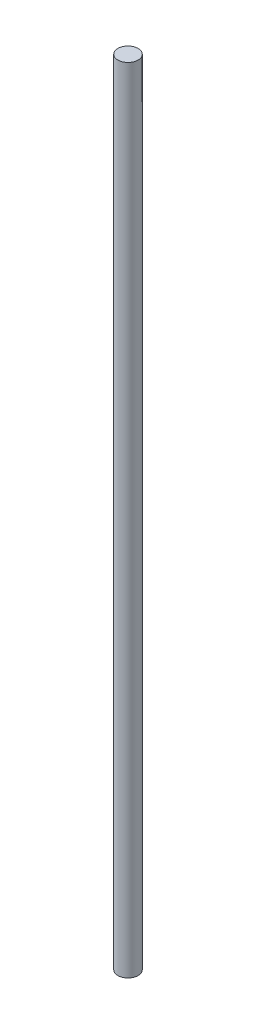
from build123d import *

# Parameters (mm, degrees)
SKETCH_1_R      = 2.8
EXTRUDE_1_DEPTH = 220


with BuildPart() as part:
    # 草图1 → 凸台-拉伸1 (new body)
    with BuildSketch(Plane(origin=(0, 0, 0), x_dir=(1, 0, 0), z_dir=(0, 1, 0))):
        with Locations(Location((0, 0, 0), (0, 0, 270))):
            Circle(SKETCH_1_R)
    extrude(amount=EXTRUDE_1_DEPTH)


solid = part.part
